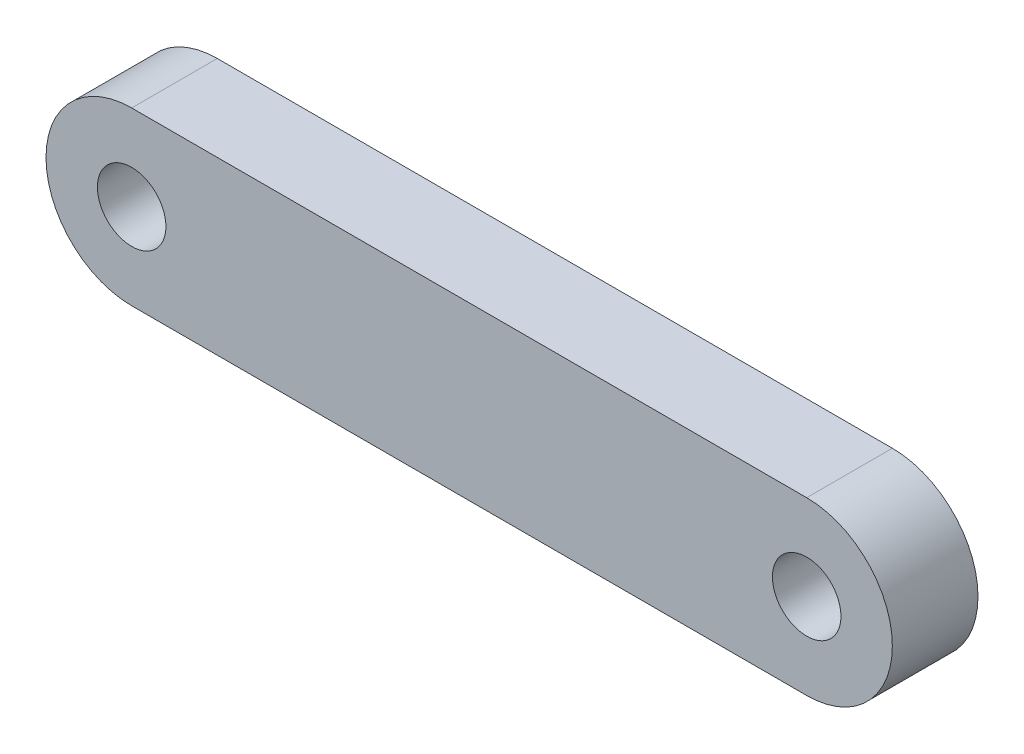
from build123d import *

# Parameters (mm, degrees)
SKETCH_2_R      = 2
EXTRUDE_1_DEPTH = 2.5


with BuildPart() as part:
    # 草圖2 → 填料-伸長1 (new, symmetric)
    with BuildSketch(Plane.XY):
        with BuildLine():
            Line((-19.7, 5), (19.7, 5))
            ThreePointArc((19.7, 5), (24.7, 0), (19.7, -5))
            Line((19.7, -5), (-19.7, -5))
            ThreePointArc((-19.7, -5), (-24.7, 0), (-19.7, 5))
        make_face()
        with Locations((19.7, 0)):
            Circle(SKETCH_2_R, mode=Mode.SUBTRACT)
        with Locations((-19.7, 0)):
            Circle(SKETCH_2_R, mode=Mode.SUBTRACT)
    extrude(amount=EXTRUDE_1_DEPTH, both=True)


solid = part.part
